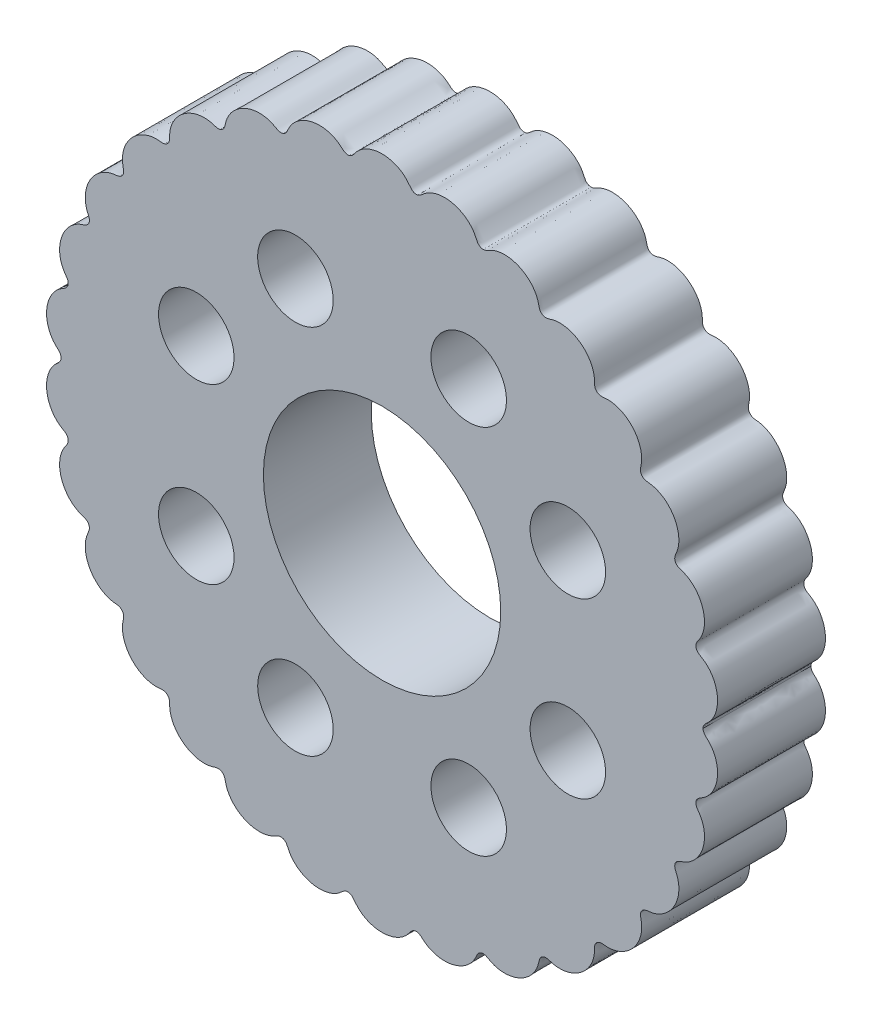
from build123d import *

# Parameters (mm, degrees)
BOSS_EXTRU_1_DEPTH      = 10
ESQUISSE2_R             = 3.5
ESQUISSE2_R_2           = 11
ENL_V_MAT_EXTRU_1_DEPTH = 46.206395047


with BuildPart() as part:
    # Esquisse1 → Boss.-Extru.1 (new body)
    with BuildSketch(Plane.XY):
        with BuildLine():
            add(Edge.make_bspline(
                [(29.75, 0), (29.75, -0.140597317), (29.868141552, -0.421461557), (30.323728325, -0.778551317), (30.756059113, -1.360631901), (31.05528351, -2.175436877), (31.1311911, -3.039210716), (30.990585079, -3.894473922), (30.697291766, -4.555148986), (30.36186421, -5.022144822), (30.060775877, -5.330577748), (29.717846033, -5.592712113), (29.328538855, -5.782182254), (29.049792204, -6.141427792), (29.111562517, -6.597079384), (29.389901644, -6.932142165), (29.605756987, -7.304556503), (29.763326521, -7.706225348), (29.890581441, -8.266803983), (29.902367273, -8.989748333), (29.697008207, -9.831679599), (29.289195496, -10.597300184), (28.696108316, -11.229222627), (28.071702237, -11.603099513), (27.513860316, -11.745290086), (27.153595417, -12.01834534), (27.094633413, -12.476886731), (27.294073027, -12.865586826), (27.433341475, -13.272169368), (27.532867261, -13.83914708), (27.496449686, -14.561800198), (27.228816643, -15.386455528), (26.764531631, -16.118443702), (26.236468325, -16.61186626), (25.745602358, -16.911413725), (25.348623221, -17.078579019), (24.930243872, -17.188384684), (24.500217935, -17.207149826), (24.083804251, -17.377842841), (23.906848881, -17.807350624), (24.015247501, -18.231768991), (24.073447524, -18.656891554), (24.062056853, -19.08873021), (23.961398047, -19.654539591), (23.689675117, -20.32471612), (23.171173996, -21.019306273), (22.608883954, -21.47280356), (22.099971556, -21.74022471), (21.559984305, -21.93443999), (20.982281642, -22.017883352), (20.416041208, -21.930735471), (19.972021705, -21.988439699), (19.688462786, -22.358972522), (19.69790625, -22.798005124), (19.673174245, -23.225799304), (19.543724586, -23.787387211), (19.229151848, -24.438621475), (18.660017359, -25.093061515), (17.946397928, -25.584588147), (17.131418747, -25.882955741), (16.410791008, -25.938043434), (15.839458095, -25.855825215), (15.437343422, -25.707694829), (14.994659593, -25.651417476), (14.623488937, -25.936605654), (14.530838201, -26.366842479), (14.424788701, -26.78151288), (14.245602688, -27.175160055), (13.933225228, -27.657279928), (13.42101245, -28.168198322), (12.672236724, -28.604290578), (11.837778732, -28.841668679), (10.972095571, -28.855360209), (10.266577085, -28.66935197), (9.778355486, -28.372966253), (9.365747914, -28.207683461), (8.932323413, -28.387404231), (8.740197599, -28.784607909), (8.556885887, -29.170933655), (8.218275705, -29.63802323), (7.675546763, -30.115566718), (6.895499115, -30.495235047), (6.046463762, -30.668270941), (5.179841061, -30.624062878), (4.494438496, -30.394918661), (4.000166127, -30.096703374), (3.68505546, -29.807717775), (3.326944679, -29.546190998), (2.861199415, -29.607519812), (2.579043887, -29.947765715), (2.239300608, -30.40625765), (1.663361794, -30.853093305), (0.860435788, -31.177849944), (3.305e-06, -31.28607424), (-0.860438264, -31.177852117), (-1.663337129, -30.853084694), (-2.239345562, -30.406277477), (-2.578974817, -29.947730674), (-2.861199778, -29.607527006), (-3.326939684, -29.546188057), (-3.685051978, -29.807717556), (-4.000165501, -30.096703111), (-4.494438307, -30.394918698), (-5.17984122, -30.624062885), (-6.046463749, -30.668270945), (-6.895499126, -30.495235047), (-7.675546761, -30.115566719), (-8.218275704, -29.638023229), (-8.556885888, -29.170933655), (-8.740197599, -28.784607909), (-8.932323413, -28.387404231), (-9.365747914, -28.207683461), (-9.778355486, -28.372966253), (-10.266577085, -28.66935197), (-10.972095571, -28.855360209), (-11.837778732, -28.841668678), (-12.672236724, -28.604290578), (-13.42101245, -28.168198322), (-13.933225228, -27.657279928), (-14.245602688, -27.175160055), (-14.424788701, -26.78151288), (-14.530838201, -26.366842479), (-14.623488937, -25.936605654), (-14.994659593, -25.651417476), (-15.437343422, -25.707694829), (-15.839458095, -25.855825215), (-16.410791008, -25.938043434), (-17.131418747, -25.882955741), (-17.946397928, -25.584588147), (-18.660017359, -25.093061515), (-19.229151848, -24.438621475), (-19.543724586, -23.787387211), (-19.673174245, -23.225799304), (-19.69790625, -22.798005124), (-19.688462786, -22.358972522), (-19.972021705, -21.988439699), (-20.416041208, -21.930735471), (-20.982281642, -22.017883352), (-21.559984305, -21.93443999), (-22.099971556, -21.74022471), (-22.608883954, -21.47280356), (-23.171173996, -21.019306273), (-23.689675117, -20.32471612), (-23.961398047, -19.654539591), (-24.062056853, -19.08873021), (-24.073447524, -18.656891554), (-24.015247501, -18.231768991), (-23.906848881, -17.807350624), (-24.083804251, -17.377842841), (-24.500217935, -17.207149826), (-24.930243872, -17.188384684), (-25.348623221, -17.078579019), (-25.745602358, -16.911413725), (-26.236468325, -16.61186626), (-26.764531631, -16.118443702), (-27.228816643, -15.386455528), (-27.496449686, -14.561800198), (-27.532867261, -13.83914708), (-27.433341475, -13.272169368), (-27.294073027, -12.865586826), (-27.094633413, -12.476886731), (-27.153595417, -12.01834534), (-27.513860316, -11.745290086), (-28.071702237, -11.603099513), (-28.696108316, -11.229222627), (-29.289195496, -10.597300184), (-29.697008207, -9.831679599), (-29.902367273, -8.989748333), (-29.890581441, -8.266803983), (-29.763326521, -7.706225348), (-29.605756987, -7.304556503), (-29.389901644, -6.932142165), (-29.111562517, -6.597079384), (-29.049792204, -6.141427792), (-29.328538855, -5.782182254), (-29.717846035, -5.592712108), (-30.060775874, -5.330577753), (-30.361864232, -5.022144787), (-30.697291735, -4.555149037), (-30.990585034, -3.894473995), (-31.131191105, -3.039210707), (-31.05528297, -2.175437752), (-30.756059941, -1.360630553), (-30.32372715, -0.778553246), (-29.868141764, -0.421461177), (-29.75, -0.140597316), (-29.75, 0)],
                knots=[0.074015259, 0.074015259, 0.074015259, 0.074015259, 0.077343265, 0.080671271, 0.087327283, 0.093983294, 0.100639306, 0.107295317, 0.113951329, 0.117279335, 0.12060734, 0.123935346, 0.127263352, 0.130591358, 0.133919364, 0.137247369, 0.140575375, 0.143903381, 0.147231387, 0.153887398, 0.16054341, 0.167199421, 0.173855433, 0.180511445, 0.18383945, 0.187167456, 0.190495462, 0.193823468, 0.197151474, 0.200479479, 0.207135491, 0.213791502, 0.220447514, 0.227103526, 0.230431531, 0.233759537, 0.237087543, 0.240415549, 0.243743555, 0.24707156, 0.250399566, 0.253727572, 0.257055578, 0.260383583, 0.267039595, 0.273695607, 0.280351618, 0.283679624, 0.28700763, 0.293663641, 0.296991647, 0.300319653, 0.303647659, 0.306975664, 0.31030367, 0.313631676, 0.320287688, 0.326943699, 0.333599711, 0.340255722, 0.346911734, 0.35023974, 0.353567745, 0.356895751, 0.360223757, 0.363551763, 0.366879769, 0.370207774, 0.37353578, 0.380191792, 0.386847803, 0.393503815, 0.400159826, 0.406815838, 0.410143844, 0.41347185, 0.416799855, 0.420127861, 0.423455867, 0.426783873, 0.433439884, 0.440095896, 0.446751907, 0.453407919, 0.460063931, 0.463391936, 0.466719942, 0.470047948, 0.473375954, 0.47670396, 0.480031965, 0.486687977, 0.493343988, 0.5, 0.506656012, 0.513312023, 0.519968035, 0.52329604, 0.526624046, 0.529952052, 0.533280058, 0.536608064, 0.539936069, 0.546592081, 0.553248093, 0.559904104, 0.566560116, 0.573216127, 0.576544133, 0.579872139, 0.583200145, 0.58652815, 0.589856156, 0.593184162, 0.599840174, 0.606496185, 0.613152197, 0.619808208, 0.62646422, 0.629792226, 0.633120231, 0.636448237, 0.639776243, 0.643104249, 0.646432255, 0.64976026, 0.653088266, 0.659744278, 0.666400289, 0.673056301, 0.679712312, 0.686368324, 0.68969633, 0.693024336, 0.696352341, 0.699680347, 0.703008353, 0.706336359, 0.71299237, 0.716320376, 0.719648382, 0.726304393, 0.732960405, 0.739616417, 0.742944422, 0.746272428, 0.749600434, 0.75292844, 0.756256445, 0.759584451, 0.762912457, 0.766240463, 0.769568469, 0.772896474, 0.779552486, 0.786208498, 0.792864509, 0.799520521, 0.802848526, 0.806176532, 0.809504538, 0.812832544, 0.81616055, 0.819488555, 0.826144567, 0.832800579, 0.83945659, 0.846112602, 0.852768613, 0.856096619, 0.859424625, 0.862752631, 0.866080636, 0.869408642, 0.872736648, 0.876064654, 0.87939266, 0.882720665, 0.886048671, 0.892704683, 0.899360694, 0.906016706, 0.912672717, 0.919328729, 0.922656735, 0.925984741, 0.925984741, 0.925984741, 0.925984741], degree=3))
            add(Edge.make_bspline(
                [(-29.75, 0), (-29.75, 0.140597316), (-29.868141764, 0.421461177), (-30.32372715, 0.778553246), (-30.756059941, 1.360630553), (-31.05528297, 2.175437752), (-31.131191105, 3.039210707), (-30.990585034, 3.894473995), (-30.697291735, 4.555149037), (-30.361864232, 5.022144787), (-30.060775874, 5.330577753), (-29.717846035, 5.592712108), (-29.328538855, 5.782182254), (-29.049792204, 6.141427792), (-29.111562517, 6.597079384), (-29.389901644, 6.932142165), (-29.605756987, 7.304556503), (-29.763326521, 7.706225348), (-29.890581441, 8.266803983), (-29.902367273, 8.989748333), (-29.697008207, 9.831679599), (-29.289195496, 10.597300184), (-28.696108316, 11.229222627), (-28.071702237, 11.603099513), (-27.513860316, 11.745290086), (-27.153595417, 12.01834534), (-27.094633413, 12.476886731), (-27.294073027, 12.865586826), (-27.433341475, 13.272169368), (-27.532867261, 13.83914708), (-27.496449686, 14.561800198), (-27.228816643, 15.386455528), (-26.764531631, 16.118443702), (-26.236468325, 16.61186626), (-25.745602358, 16.911413725), (-25.348623221, 17.078579019), (-24.930243872, 17.188384684), (-24.500217935, 17.207149826), (-24.083804251, 17.377842841), (-23.906848881, 17.807350624), (-24.015247501, 18.231768991), (-24.073447524, 18.656891554), (-24.062056853, 19.08873021), (-23.961398047, 19.654539591), (-23.689675117, 20.32471612), (-23.171173996, 21.019306273), (-22.608883954, 21.47280356), (-22.099971556, 21.74022471), (-21.559984305, 21.93443999), (-20.982281642, 22.017883352), (-20.416041208, 21.930735471), (-19.972021705, 21.988439699), (-19.688462786, 22.358972522), (-19.69790625, 22.798005124), (-19.673174245, 23.225799304), (-19.543724586, 23.787387211), (-19.229151848, 24.438621475), (-18.660017359, 25.093061515), (-17.946397928, 25.584588147), (-17.131418747, 25.882955741), (-16.410791008, 25.938043434), (-15.839458095, 25.855825215), (-15.437343422, 25.707694829), (-14.994659593, 25.651417476), (-14.623488937, 25.936605654), (-14.530838201, 26.366842479), (-14.424788701, 26.78151288), (-14.245602688, 27.175160055), (-13.933225228, 27.657279928), (-13.42101245, 28.168198322), (-12.672236724, 28.604290578), (-11.837778732, 28.841668678), (-10.972095571, 28.855360209), (-10.266577085, 28.669351969), (-9.778355486, 28.372966253), (-9.365747914, 28.207683461), (-8.932323413, 28.387404231), (-8.740197599, 28.784607909), (-8.556885888, 29.170933655), (-8.218275704, 29.638023229), (-7.675546761, 30.115566719), (-6.895499126, 30.495235047), (-6.046463749, 30.668270945), (-5.17984122, 30.624062885), (-4.494438307, 30.394918698), (-4.000165501, 30.096703111), (-3.685051978, 29.807717556), (-3.326939684, 29.546188057), (-2.861199778, 29.607527006), (-2.578974817, 29.947730674), (-2.239345562, 30.406277477), (-1.663337129, 30.853084694), (-0.860438264, 31.177852117), (3.305e-06, 31.28607424), (0.860435788, 31.177849944), (1.663361794, 30.853093305), (2.239300608, 30.40625765), (2.579043887, 29.947765715), (2.861199415, 29.607519812), (3.326944679, 29.546190998), (3.68505546, 29.807717775), (4.000166127, 30.096703374), (4.494438496, 30.394918661), (5.179841061, 30.624062878), (6.046463762, 30.668270941), (6.895499115, 30.495235047), (7.675546763, 30.115566718), (8.218275705, 29.63802323), (8.556885887, 29.170933655), (8.740197599, 28.784607909), (8.932323413, 28.387404231), (9.365747914, 28.207683461), (9.778355486, 28.372966253), (10.266577085, 28.66935197), (10.972095571, 28.855360209), (11.837778732, 28.841668678), (12.672236724, 28.604290578), (13.42101245, 28.168198322), (13.933225228, 27.657279928), (14.245602688, 27.175160055), (14.424788701, 26.78151288), (14.530838201, 26.366842479), (14.623488937, 25.936605654), (14.994659593, 25.651417476), (15.437343422, 25.707694829), (15.839458095, 25.855825215), (16.410791008, 25.938043434), (17.131418747, 25.882955741), (17.946397928, 25.584588147), (18.660017359, 25.093061515), (19.229151848, 24.438621475), (19.543724586, 23.787387211), (19.673174245, 23.225799304), (19.69790625, 22.798005124), (19.688462786, 22.358972522), (19.972021705, 21.988439699), (20.416041208, 21.930735471), (20.982281642, 22.017883352), (21.559984305, 21.93443999), (22.099971556, 21.74022471), (22.608883954, 21.47280356), (23.171173996, 21.019306273), (23.689675117, 20.32471612), (23.961398047, 19.654539591), (24.062056853, 19.08873021), (24.073447524, 18.656891554), (24.015247501, 18.231768991), (23.906848881, 17.807350624), (24.083804251, 17.377842841), (24.500217935, 17.207149826), (24.930243872, 17.188384684), (25.348623221, 17.078579019), (25.745602358, 16.911413725), (26.236468325, 16.61186626), (26.764531631, 16.118443702), (27.228816643, 15.386455528), (27.496449686, 14.561800198), (27.532867261, 13.83914708), (27.433341475, 13.272169368), (27.294073027, 12.865586826), (27.094633413, 12.476886731), (27.153595417, 12.01834534), (27.513860316, 11.745290086), (28.071702237, 11.603099513), (28.696108316, 11.229222627), (29.289195496, 10.597300184), (29.697008207, 9.831679599), (29.902367273, 8.989748333), (29.890581441, 8.266803983), (29.763326521, 7.706225348), (29.605756987, 7.304556503), (29.389901644, 6.932142165), (29.111562517, 6.597079384), (29.049792204, 6.141427792), (29.328538855, 5.782182254), (29.717846033, 5.592712113), (30.060775877, 5.330577748), (30.36186421, 5.022144822), (30.697291766, 4.555148986), (30.990585079, 3.894473922), (31.1311911, 3.039210716), (31.05528351, 2.175436877), (30.756059113, 1.360631901), (30.323728325, 0.778551317), (29.868141552, 0.421461557), (29.75, 0.140597317), (29.75, 0)],
                knots=[0.074015259, 0.074015259, 0.074015259, 0.074015259, 0.077343265, 0.080671271, 0.087327283, 0.093983294, 0.100639306, 0.107295317, 0.113951329, 0.117279335, 0.12060734, 0.123935346, 0.127263352, 0.130591358, 0.133919364, 0.137247369, 0.140575375, 0.143903381, 0.147231387, 0.153887398, 0.16054341, 0.167199421, 0.173855433, 0.180511445, 0.18383945, 0.187167456, 0.190495462, 0.193823468, 0.197151474, 0.200479479, 0.207135491, 0.213791502, 0.220447514, 0.227103526, 0.230431531, 0.233759537, 0.237087543, 0.240415549, 0.243743555, 0.24707156, 0.250399566, 0.253727572, 0.257055578, 0.260383583, 0.267039595, 0.273695607, 0.280351618, 0.283679624, 0.28700763, 0.293663641, 0.296991647, 0.300319653, 0.303647659, 0.306975664, 0.31030367, 0.313631676, 0.320287688, 0.326943699, 0.333599711, 0.340255722, 0.346911734, 0.35023974, 0.353567745, 0.356895751, 0.360223757, 0.363551763, 0.366879769, 0.370207774, 0.37353578, 0.380191792, 0.386847803, 0.393503815, 0.400159826, 0.406815838, 0.410143844, 0.41347185, 0.416799855, 0.420127861, 0.423455867, 0.426783873, 0.433439884, 0.440095896, 0.446751907, 0.453407919, 0.460063931, 0.463391936, 0.466719942, 0.470047948, 0.473375954, 0.47670396, 0.480031965, 0.486687977, 0.493343988, 0.5, 0.506656012, 0.513312023, 0.519968035, 0.52329604, 0.526624046, 0.529952052, 0.533280058, 0.536608064, 0.539936069, 0.546592081, 0.553248093, 0.559904104, 0.566560116, 0.573216127, 0.576544133, 0.579872139, 0.583200145, 0.58652815, 0.589856156, 0.593184162, 0.599840174, 0.606496185, 0.613152197, 0.619808208, 0.62646422, 0.629792226, 0.633120231, 0.636448237, 0.639776243, 0.643104249, 0.646432255, 0.64976026, 0.653088266, 0.659744278, 0.666400289, 0.673056301, 0.679712312, 0.686368324, 0.68969633, 0.693024336, 0.696352341, 0.699680347, 0.703008353, 0.706336359, 0.71299237, 0.716320376, 0.719648382, 0.726304393, 0.732960405, 0.739616417, 0.742944422, 0.746272428, 0.749600434, 0.75292844, 0.756256445, 0.759584451, 0.762912457, 0.766240463, 0.769568469, 0.772896474, 0.779552486, 0.786208498, 0.792864509, 0.799520521, 0.802848526, 0.806176532, 0.809504538, 0.812832544, 0.81616055, 0.819488555, 0.826144567, 0.832800579, 0.83945659, 0.846112602, 0.852768613, 0.856096619, 0.859424625, 0.862752631, 0.866080636, 0.869408642, 0.872736648, 0.876064654, 0.87939266, 0.882720665, 0.886048671, 0.892704683, 0.899360694, 0.906016706, 0.912672717, 0.919328729, 0.922656735, 0.925984741, 0.925984741, 0.925984741, 0.925984741], degree=3))
        make_face()
    extrude(amount=BOSS_EXTRU_1_DEPTH)

    # Esquisse2 → Enlèv. mat.-Extru.1 (cut, through all)
    with BuildSketch(Plane.XY.offset(10)):
        with Locations((-8.029746973, 17.219847954)):
            Circle(ESQUISSE2_R)
        with Locations(Location((8.029746973, 17.219847954, 0), (0, 0, 180))):
            Circle(ESQUISSE2_R)
        with Locations((17.219847954, 8.029746973)):
            Circle(ESQUISSE2_R)
        with Locations(Location((17.219847954, -8.029746973, 0), (0, 0, 180))):
            Circle(ESQUISSE2_R)
        with Locations((8.029746973, -17.219847954)):
            Circle(ESQUISSE2_R)
        with Locations(Location((-8.029746973, -17.219847954, 0), (0, 0, 180))):
            Circle(ESQUISSE2_R)
        with Locations((-17.219847954, -8.029746973)):
            Circle(ESQUISSE2_R)
        with Locations(Location((-17.219847954, 8.029746973, 0), (0, 0, 180))):
            Circle(ESQUISSE2_R)
        Circle(ESQUISSE2_R_2)
    extrude(amount=-ENL_V_MAT_EXTRU_1_DEPTH, mode=Mode.SUBTRACT)


solid = part.part
